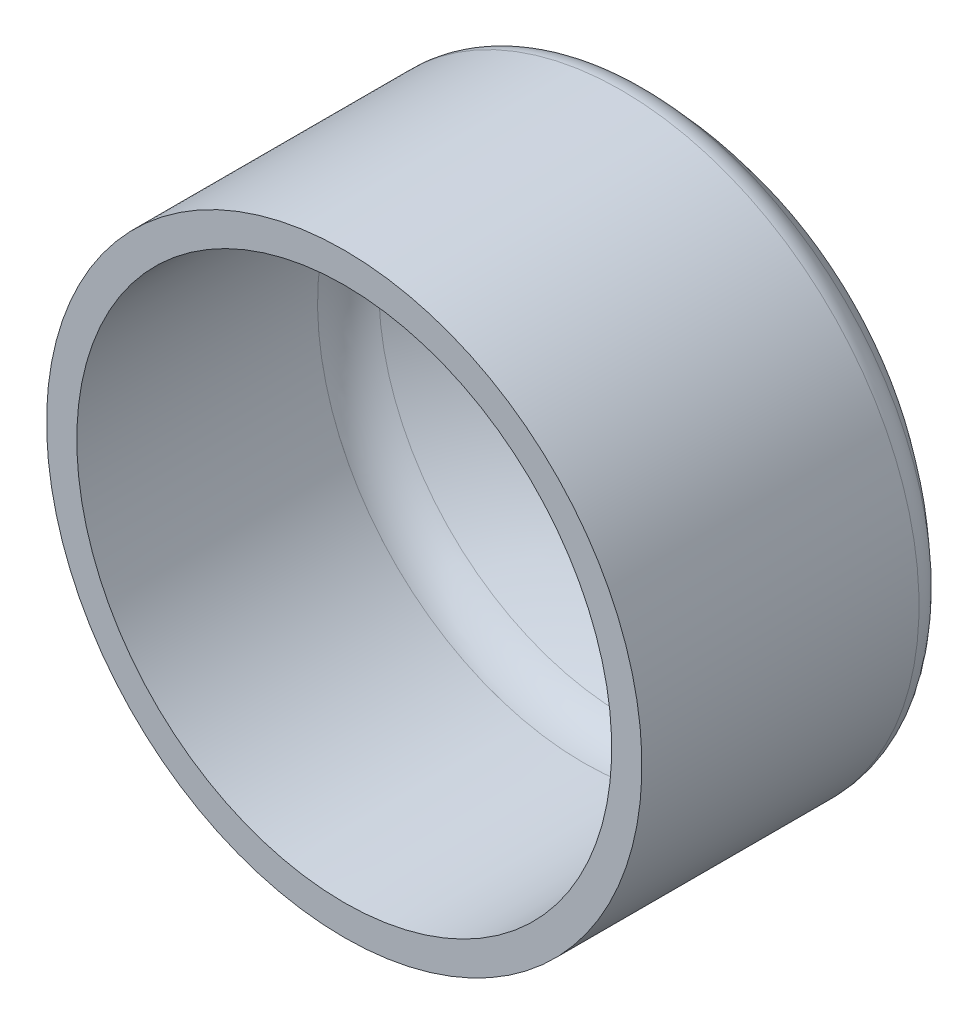
from build123d import *

# Parameters (mm, degrees)
FILLET1_R = 6.35


with BuildPart() as part:
    # Sketch2 → Revolve1 (revolve)
    with BuildSketch(Plane(origin=(0, 0, 0), x_dir=(0, 0, -1), z_dir=(1, 0, 0))):
        with BuildLine():
            Line((35.6108, 0), (44.3992, 0))
            ThreePointArc((44.3992, 0), (37.458984081, -34.604022474), (17.711827813, -63.8556))
            Line((17.711827813, -63.8556), (-44.3992, -63.8556))
            Line((-44.3992, -63.8556), (-44.3992, -57.3786))
            Line((-44.3992, -57.3786), (6.9088, -57.0357))
            Line((6.9088, -57.0357), (6.910792633, -57.0357))
            ThreePointArc((6.910792633, -57.0357), (11.868455582, -55.955071974), (15.926669287, -52.909241979))
            ThreePointArc((15.926669287, -52.909241979), (30.530340961, -28.226108874), (35.6108, 0))
        make_face()
    revolve(axis=Axis((0, 0, 44.3992), (0, 0, -1)))

    # Fillet1
    fillet1_edges = [part.edges().sort_by_distance(p)[0] for p in [
        (0, 63.8556, -17.711827813),
    ]]
    fillet(fillet1_edges, radius=FILLET1_R)


solid = part.part
